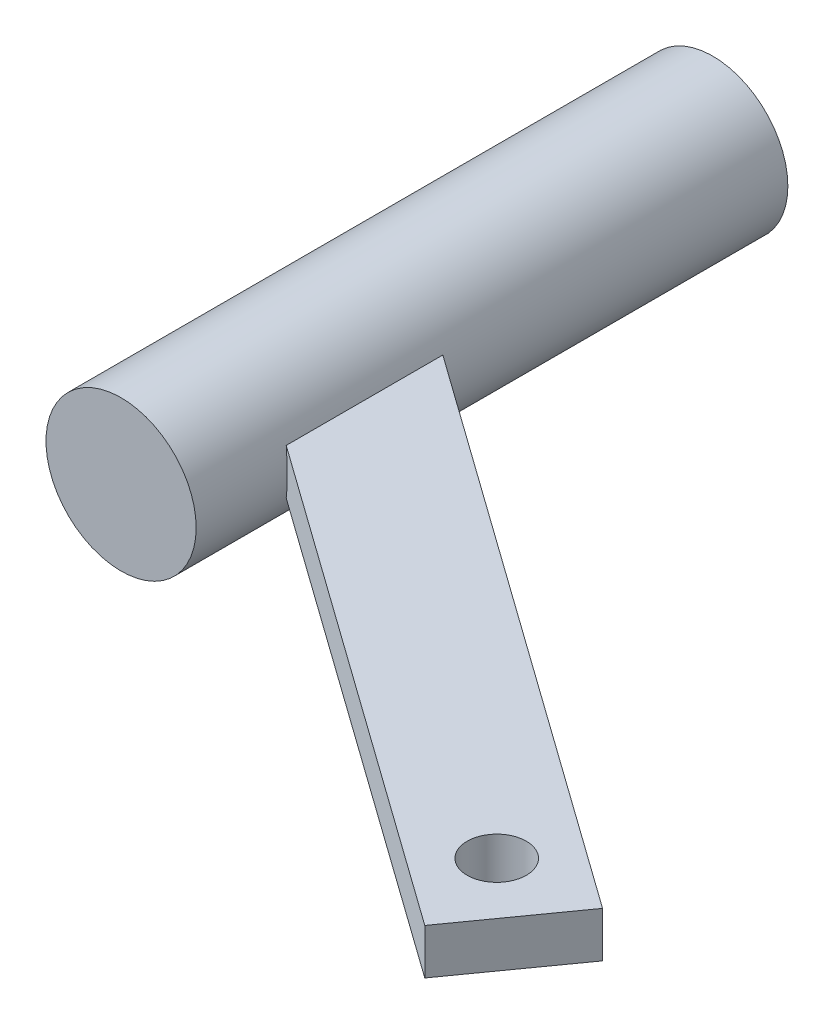
from build123d import *

# Parameters (mm, degrees)
SKETCH1_R                = 16.5
BOSS_EXTRUDE1_DEPTH      = 130
BOSS_EXTRUDE2_DEPTH      = 5
BOSS_EXTRUDE2_DEPTH_BACK = 5
SKETCH3_R                = 6.5
CUT_EXTRUDE1_DEPTH       = 20


with BuildPart() as part:
    # Sketch1 → Boss-Extrude1 (new body)
    with BuildSketch(Plane.XY):
        Circle(SKETCH1_R)
    extrude(amount=BOSS_EXTRUDE1_DEPTH)

    # Sketch2 → Boss-Extrude2 (add, two sides: drawn at the far end of the back side and taken through both)
    with BuildSketch(Plane(origin=(0, 0, 0), x_dir=(1, 0, 0), z_dir=(0, 1, 0)).offset(-BOSS_EXTRUDE2_DEPTH_BACK)):
        Polygon((0, -98.214285714), (122.285351257, -185.560965183), (138.560020681, -162.77642799), (0, -63.804984646), align=None)
    extrude(amount=BOSS_EXTRUDE2_DEPTH + BOSS_EXTRUDE2_DEPTH_BACK)

    # Sketch3 → Cut-Extrude1 (cut)
    with BuildSketch(Plane(origin=(0, 5, 0), x_dir=(1, 0, 0), z_dir=(0, 1, 0))):
        with Locations((117.40295043, -164.868885487)):
            Circle(SKETCH3_R)
    extrude(amount=-CUT_EXTRUDE1_DEPTH, mode=Mode.SUBTRACT)


solid = part.part
